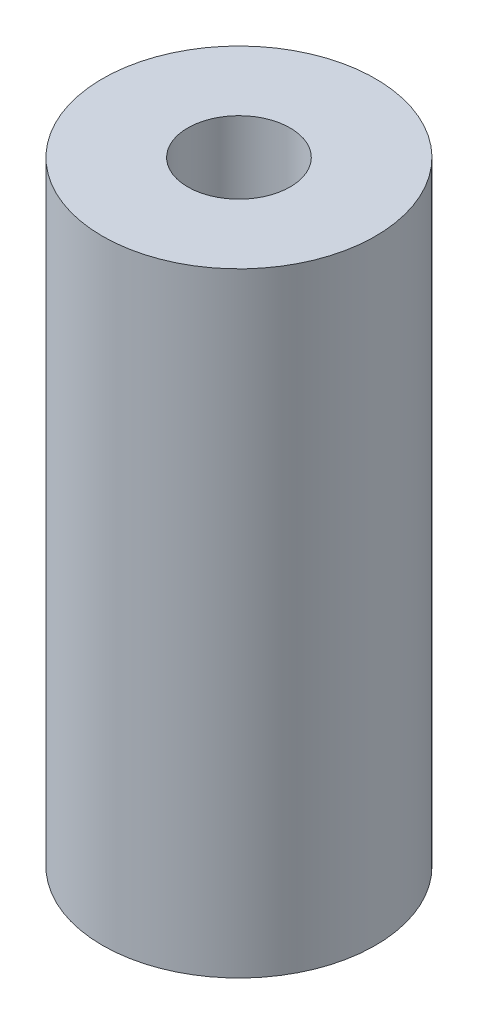
from build123d import *

# Parameters (mm, degrees)
SKETCH1_R           = 4
SKETCH1_R_2         = 1.5
BOSS_EXTRUDE1_DEPTH = 18


with BuildPart() as part:
    # Sketch1 → Boss-Extrude1 (new body)
    with BuildSketch(Plane(origin=(0, 0, 0), x_dir=(1, 0, 0), z_dir=(0, 1, 0))):
        with Locations(Location((0, 0, 0), (0, 0, 270))):
            Circle(SKETCH1_R)
        with Locations(Location((0, 0, 0), (0, 0, 270))):
            Circle(SKETCH1_R_2, mode=Mode.SUBTRACT)
    extrude(amount=BOSS_EXTRUDE1_DEPTH)


solid = part.part
